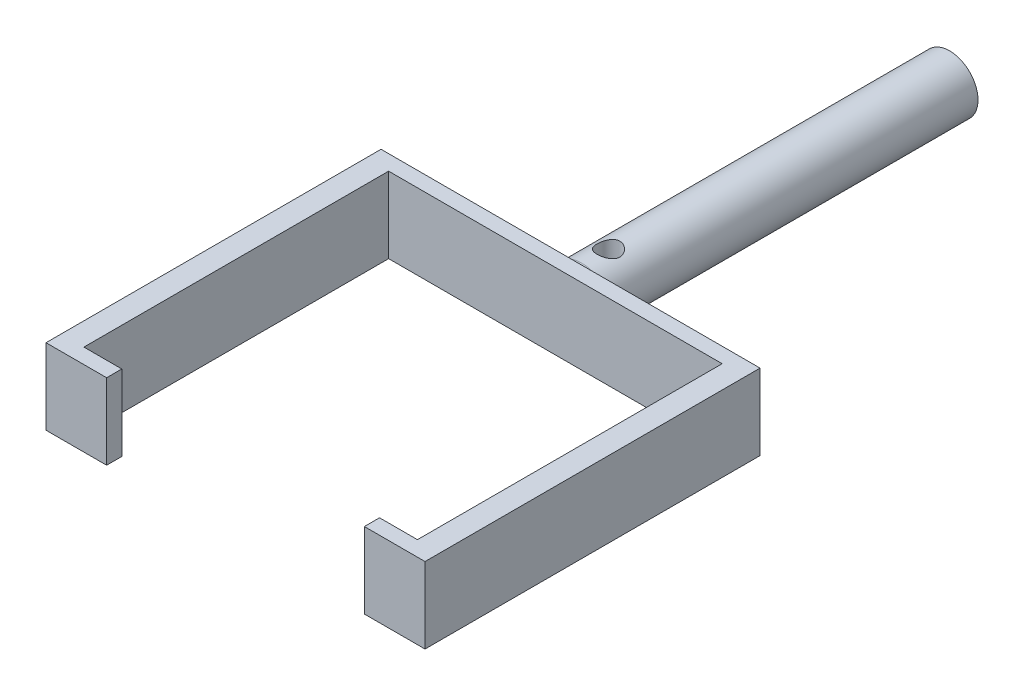
from build123d import *

# Parameters (mm, degrees)
ESBO_O1_R                = 3.75
RESSALTO_EXTRUS_O1_DEPTH = 50
RESSALTO_EXTRUS_O2_DEPTH = 2
ESBO_O3_W                = 3
ESBO_O3_H                = 10
RESSALTO_EXTRUS_O3_DEPTH = 42.2
ESBO_O4_W                = 2
ESBO_O4_H                = 10
RESSALTO_EXTRUS_O4_DEPTH = 5
ESBO_O5_W                = 2
ESBO_O5_H                = 10
RESSALTO_EXTRUS_O5_DEPTH = 5
FILETE1_R                = 1.5
ESBO_O6_R                = 1.5
CORTE_EXTRUS_O1_DEPTH    = 5


with BuildPart() as part:
    # Esboço1 → Ressalto-extrusão1 (new body)
    with BuildSketch(Plane.XY):
        Circle(ESBO_O1_R)
    extrude(amount=RESSALTO_EXTRUS_O1_DEPTH)

    # Esboço2 → Ressalto-extrusão2 (add)
    with BuildSketch(Plane.XY.offset(50)):
        with BuildLine():
            Line((0, 5), (0, 3.75))
            ThreePointArc((0, 3.75), (2.651650429, 2.651650429), (3.75, 0))
            ThreePointArc((3.75, 0), (2.651650429, -2.651650429), (0, -3.75))
            Line((0, -3.75), (0, -5))
            Line((0, -5), (25, -5))
            Line((25, -5), (25, 5))
            Line((25, 5), (0, 5))
        make_face()
        with BuildLine():
            ThreePointArc((0, -3.75), (-3.75, 0), (0, 3.75))
            Line((0, 3.75), (0, 5))
            Line((0, 5), (-25, 5))
            Line((-25, 5), (-25, -5))
            Line((-25, -5), (0, -5))
            Line((0, -5), (0, -3.75))
        make_face()
        with BuildLine():
            Line((0, -3.75), (0, 0))
            Line((0, 0), (0, 3.75))
            ThreePointArc((0, 3.75), (-3.75, 0), (0, -3.75))
        make_face()
        with BuildLine():
            Line((0, 3.75), (0, 0))
            Line((0, 0), (0, -3.75))
            ThreePointArc((0, -3.75), (2.651650429, -2.651650429), (3.75, 0))
            ThreePointArc((3.75, 0), (2.651650429, 2.651650429), (0, 3.75))
        make_face()
    extrude(amount=RESSALTO_EXTRUS_O2_DEPTH)

    # Esboço3 → Ressalto-extrusão3 (add)
    with BuildSketch(Plane.XY.offset(52)):
        with Locations((-23.5, 0)):
            Rectangle(ESBO_O3_W, ESBO_O3_H)
        with Locations((23.5, 0)):
            Rectangle(ESBO_O3_W, ESBO_O3_H)
    extrude(amount=RESSALTO_EXTRUS_O3_DEPTH)

    # Esboço4 → Ressalto-extrusão4 (add)
    with BuildSketch(Plane(origin=(-22, 0, 0), x_dir=(0, 0, -1), z_dir=(1, 0, 0))):
        with Locations((-93.2, 0)):
            Rectangle(ESBO_O4_W, ESBO_O4_H)
    extrude(amount=RESSALTO_EXTRUS_O4_DEPTH)

    # Esboço5 → Ressalto-extrusão5 (add)
    with BuildSketch(Plane.ZY.offset(-22)):
        with Locations((93.2, 0)):
            Rectangle(ESBO_O5_W, ESBO_O5_H)
    extrude(amount=RESSALTO_EXTRUS_O5_DEPTH)

    # Filete1
    filete1_edges = [part.edges().sort_by_distance(p)[0] for p in [
        (-3.75, 0, 50),
    ]]
    fillet(filete1_edges, radius=FILETE1_R)

    # Esboço6 → Corte-extrusão1 (cut, symmetric)
    with BuildSketch(Plane(origin=(0, 0, 0), x_dir=(1, 0, 0), z_dir=(0, 1, 0))):
        with Locations(Location((0, -45, 0), (0, 0, 270))):
            Circle(ESBO_O6_R)
    extrude(amount=CORTE_EXTRUS_O1_DEPTH, both=True, mode=Mode.SUBTRACT)


solid = part.part
